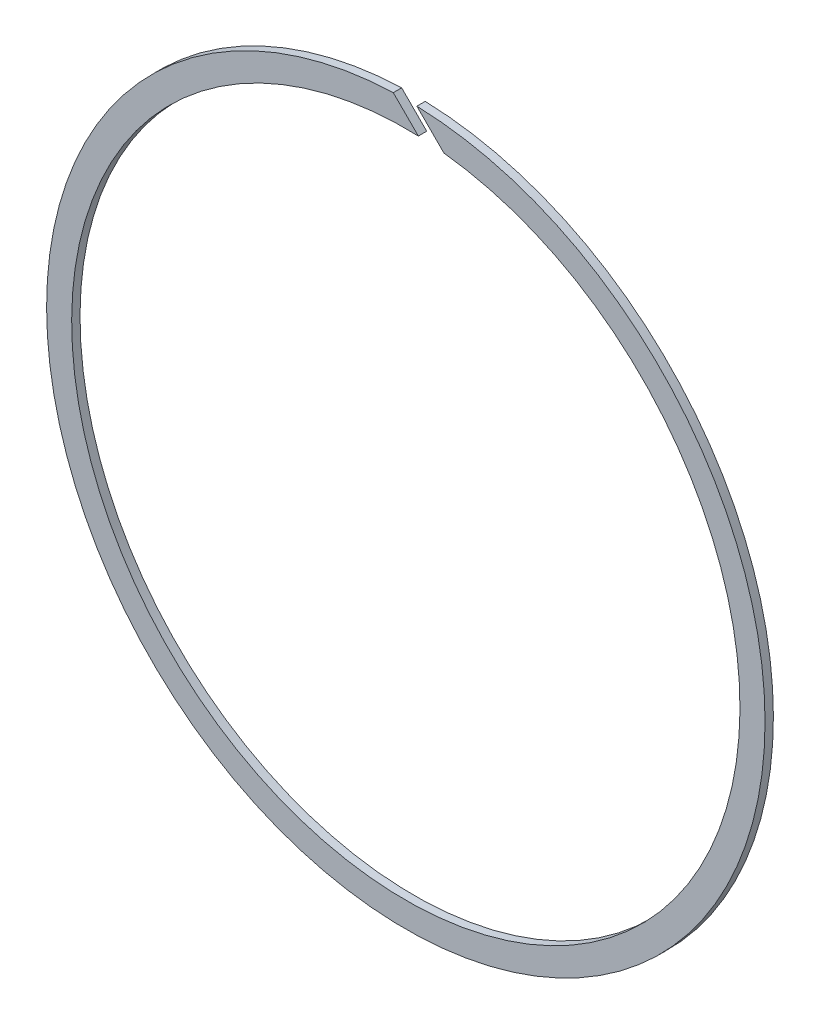
from build123d import *

# Parameters (mm, degrees)
BOSS_EXTRUDE1_DEPTH = 0.25


with BuildPart() as part:
    # Sketch1 → Boss-Extrude1 (new, symmetric)
    with BuildSketch(Plane.XY):
        with BuildLine():
            Line((0.660775798, 21.489843539), (2.281134566, 19.869484772))
            ThreePointArc((2.281134566, 19.869484772), (-1.516930575, -19.942390068), (0.75049168, 19.985914096))
            Line((0.75049168, 19.985914096), (-0.75049168, 21.486897455))
            ThreePointArc((-0.75049168, 21.486897455), (0.04488212, -21.499953153), (0.660775798, 21.489843539))
        make_face()
    extrude(amount=BOSS_EXTRUDE1_DEPTH, both=True)


solid = part.part
